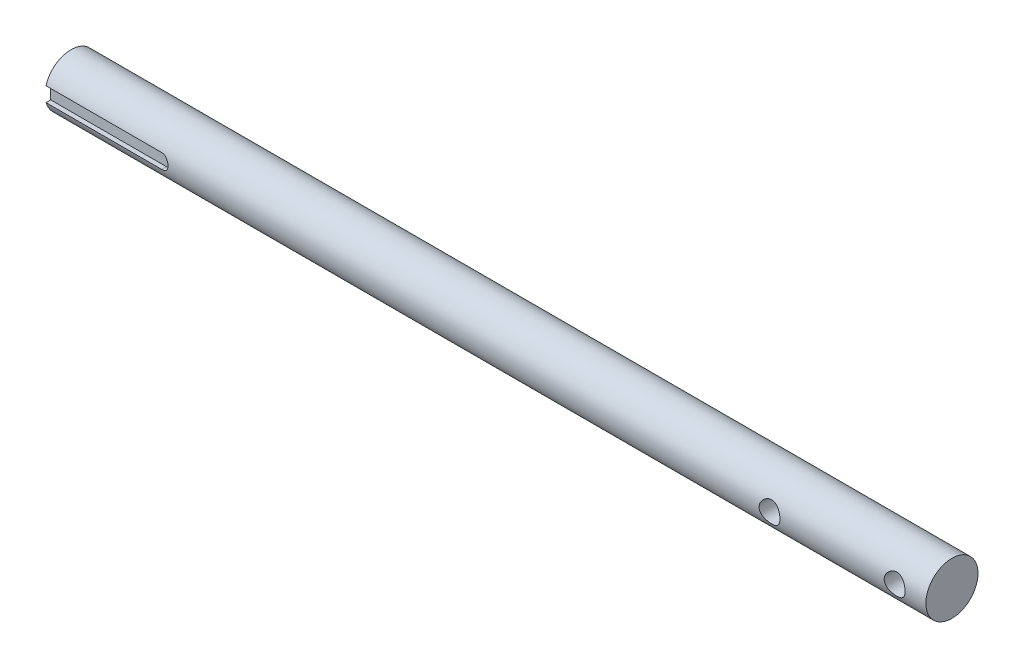
from build123d import *

# Parameters (mm, degrees)
SKETCH1_R           = 25
BOSS_EXTRUDE1_DEPTH = 422.5
SKETCH2_R           = 10
CUT_EXTRUDE1_DEPTH  = 160
CUT_EXTRUDE3_DEPTH  = 5.5


with BuildPart() as part:
    # Sketch1 → Boss-Extrude1 (new, symmetric)
    with BuildSketch(Plane(origin=(0, 0, 0), x_dir=(0, 0, -1), z_dir=(1, 0, 0))):
        Circle(SKETCH1_R)
    extrude(amount=BOSS_EXTRUDE1_DEPTH, both=True)

    # Sketch2 → Cut-Extrude1 (cut, symmetric)
    with BuildSketch(Plane.XY):
        with Locations((392.5, 0)):
            Circle(SKETCH2_R)
        with Locations((272.5, 0)):
            Circle(SKETCH2_R)
    extrude(amount=CUT_EXTRUDE1_DEPTH, both=True, mode=Mode.SUBTRACT)

    # Sketch4 → Cut-Extrude3 (cut)
    with BuildSketch(Plane.XY.offset(25)):
        with BuildLine():
            Line((-422.5, 7), (-311.5, 7))
            ThreePointArc((-311.5, 7), (-304.5, 0), (-311.5, -7))
            Line((-311.5, -7), (-422.5, -7))
            ThreePointArc((-422.5, -7), (-429.5, 0), (-422.5, 7))
        make_face()
    extrude(amount=-CUT_EXTRUDE3_DEPTH, mode=Mode.SUBTRACT)


solid = part.part
